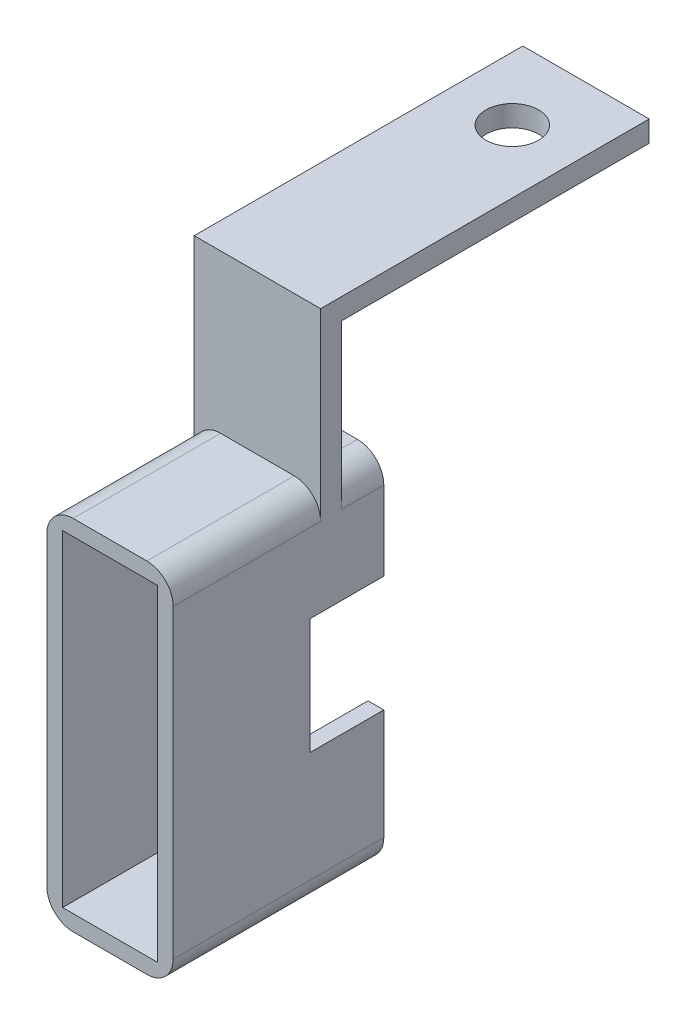
from build123d import *

# Parameters (mm, degrees)
ESQUISSE1_W                  = 9
ESQUISSE1_H                  = 31
BOSS_EXTRU_1_DEPTH           = 20
ESQUISSE3_W                  = 12
ESQUISSE3_H                  = 2
BOSS_EXTRU_2_DEPTH           = 15
ESQUISSE4_W                  = 12
ESQUISSE4_H                  = 2
BOSS_EXTRU_3_DEPTH           = 29.2
ESQUISSE5_R                  = 2.5
ENL_V_MAT_EXTRU_3_DEPTH      = 10
CONG_1_R                     = 2.5
CONG_2_R                     = 2.5
ENL_V_MAT_EXTRU_2_DEPTH      = 43.629642176
ENL_V_MAT_EXTRU_2_DEPTH_BACK = 5
ESQUISSE2_W                  = 7
ESQUISSE2_H                  = 11
ENL_V_MAT_EXTRU_5_DEPTH      = 43.629642176
ENL_V_MAT_EXTRU_5_DEPTH_BACK = 5
ESQUISSE6_W                  = 7
ESQUISSE6_H                  = 9


with BuildPart() as part:
    # Esquisse1 → Boss.-Extru.1 (new body)
    with BuildSketch(Plane.XY):
        Polygon((-22.275714661, 15.721830986), (-22.275714661, -12.778169014), (-22.275714661, -16.778169014), (-10.275714661, -16.778169014), (-10.275714661, 17.221830986), (-22.275714661, 17.221830986), align=None)
        with Locations((-16.275714661, 0.221830986)):
            Rectangle(ESQUISSE1_W, ESQUISSE1_H, mode=Mode.SUBTRACT)
    extrude(amount=BOSS_EXTRU_1_DEPTH)

    # Esquisse3 → Boss.-Extru.2 (add)
    with BuildSketch(Plane(origin=(0, 17.221830986, 0), x_dir=(1, 0, 0), z_dir=(0, 1, 0))):
        with Locations((-16.275714661, -5)):
            Rectangle(ESQUISSE3_W, ESQUISSE3_H)
    extrude(amount=BOSS_EXTRU_2_DEPTH)

    # Esquisse4 → Boss.-Extru.3 (add)
    with BuildSketch(Plane(origin=(0, 0, 4), x_dir=(-1, 0, 0), z_dir=(0, 0, -1))):
        with Locations((16.275714661, 31.221830986)):
            Rectangle(ESQUISSE4_W, ESQUISSE4_H)
    extrude(amount=BOSS_EXTRU_3_DEPTH)

    # Esquisse5 → Enlèv. mat.-Extru.3 (cut)
    with BuildSketch(Plane(origin=(0, 32.221830986, 0), x_dir=(1, 0, 0), z_dir=(0, 1, 0))):
        with Locations(Location((-16.275714661, 18.2, 0), (0, 0, 270))):
            Circle(ESQUISSE5_R)
    extrude(amount=-ENL_V_MAT_EXTRU_3_DEPTH, mode=Mode.SUBTRACT)

    # Congé1
    cong_1_edges = [part.edges().sort_by_distance(p)[0] for p in [
        (-10.275714661, 17.221830986, 13),
        (-10.275714661, -16.778169014, 10),
    ]]
    fillet(cong_1_edges, radius=CONG_1_R)

    # Congé2
    cong_2_edges = [part.edges().sort_by_distance(p)[0] for p in [
        (-22.275714661, 17.221830986, 13),
        (-22.275714661, -16.778169014, 10),
        (-22.275714661, 17.221830986, 2),
        (-10.275714661, 17.221830986, 2),
    ]]
    fillet(cong_2_edges, radius=CONG_2_R)

    # Esquisse2 → Enlèv. mat.-Extru.2 (cut, two sides: drawn at the far end of the back side and taken through both)
    with BuildSketch(Plane(origin=(-10.275714661, 0, 0), x_dir=(0, 0, -1), z_dir=(1, 0, 0)).offset(-ENL_V_MAT_EXTRU_2_DEPTH_BACK)):
        with Locations((-3.5, 1.721830986)):
            Rectangle(ESQUISSE2_W, ESQUISSE2_H)
    extrude(amount=ENL_V_MAT_EXTRU_2_DEPTH + ENL_V_MAT_EXTRU_2_DEPTH_BACK, mode=Mode.SUBTRACT)

    # Esquisse6 → Enlèv. mat.-Extru.5 (cut, two sides: drawn at the far end of the back side and taken through both)
    with BuildSketch(Plane.ZY.offset(22.275714661).offset(-ENL_V_MAT_EXTRU_5_DEPTH_BACK)):
        with Locations((3.5, -0.278169014)):
            Rectangle(ESQUISSE6_W, ESQUISSE6_H)
    extrude(amount=ENL_V_MAT_EXTRU_5_DEPTH + ENL_V_MAT_EXTRU_5_DEPTH_BACK, mode=Mode.SUBTRACT)


solid = part.part
